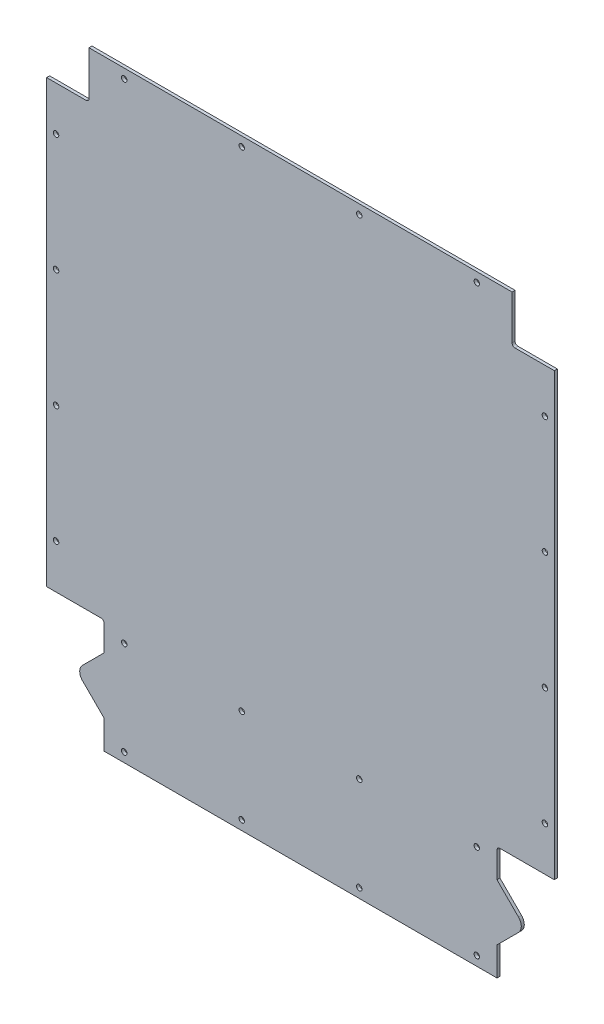
from build123d import *

# Parameters (mm, degrees)
SKETCH2_W            = 540
SKETCH2_H            = 640
BOSS_EXTRUDE1_DEPTH  = 3.175
SKETCH3_W            = 45
SKETCH3_H            = 50
CUT_EXTRUDE1_DEPTH   = 838.382875765
FILLET1_R            = 10
FILLET2_R            = 3.175
M5_CLEARANCE_HOLE1_D = 5.8
LPATTERN1_COUNT      = 4
LPATTERN1_PITCH      = 125
M5_CLEARANCE_HOLE2_D = 5.8
LPATTERN2_COUNT      = 4
LPATTERN2_PITCH      = 125


with BuildPart() as part:
    # Sketch2 → Boss-Extrude1 (new body)
    with BuildSketch(Plane.XY):
        with Locations((270, 320)):
            Rectangle(SKETCH2_W, SKETCH2_H)
    extrude(amount=BOSS_EXTRUDE1_DEPTH)

    # Sketch3 → Cut-Extrude1 (cut, through all)
    with BuildSketch(Plane.XY.offset(3.175)):
        with Locations((22.5, 615)):
            Rectangle(SKETCH3_W, SKETCH3_H)
        Polygon((0, 121), (61, 121), (61, 90.5), (31, 60.5), (61, 30.5), (61, 0), (0, 0), align=None)
        Polygon((540, 0), (540, 121), (479, 121), (479, 90.5), (509, 60.5), (479, 30.5), (479, 0), align=None)
        with Locations((517.5, 615)):
            Rectangle(SKETCH3_W, SKETCH3_H)
    extrude(amount=-CUT_EXTRUDE1_DEPTH, mode=Mode.SUBTRACT)

    # Fillet1
    fillet1_edges = [part.edges().sort_by_distance(p)[0] for p in [
        (31, 60.5, 1.5875),
        (509, 60.5, 1.5875),
    ]]
    fillet(fillet1_edges, radius=FILLET1_R)

    # Fillet2
    fillet2_edges = [part.edges().sort_by_distance(p)[0] for p in [
        (45, 590, 1.5875),
        (61, 121, 1.5875),
        (479, 121, 1.5875),
        (495, 590, 1.5875),
    ]]
    fillet(fillet2_edges, radius=FILLET2_R)

    # M5 Clearance Hole1 (through all)
    with Locations(Plane(origin=(82.5, 10, 3.175), x_dir=(1, 0, 0), z_dir=(0, 0, 1))):
        with Locations((0, 0), (0, 100), (0, 620)):
            m5_clearance_hole1 = Hole(M5_CLEARANCE_HOLE1_D / 2)

    # LPattern1: M5 Clearance Hole1 ×4
    with Locations(*[(i * LPATTERN1_PITCH, 0, 0) for i in range(1, LPATTERN1_COUNT)]):
        add(m5_clearance_hole1, mode=Mode.SUBTRACT)

    # M5 Clearance Hole2 (through all)
    with Locations(Plane(origin=(10, 168, 3.175), x_dir=(1, 0, 0), z_dir=(0, 0, 1))):
        with Locations((0, 0), (520, 0)):
            m5_clearance_hole2 = Hole(M5_CLEARANCE_HOLE2_D / 2)

    # LPattern2: M5 Clearance Hole2 ×4
    with Locations(*[(0, i * LPATTERN2_PITCH, 0) for i in range(1, LPATTERN2_COUNT)]):
        add(m5_clearance_hole2, mode=Mode.SUBTRACT)


solid = part.part
